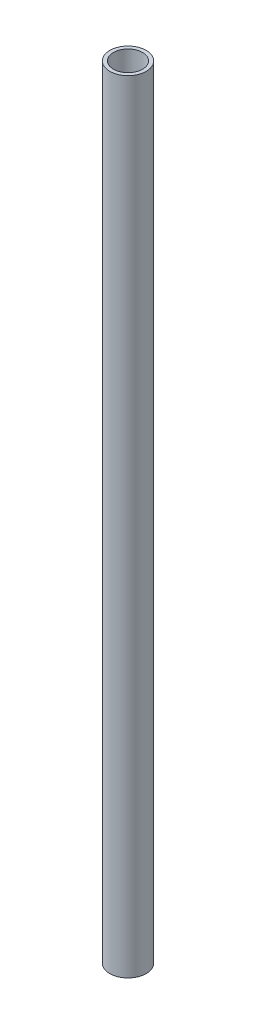
from build123d import *

# Parameters (mm, degrees)
TUBE_ROND_R            = 5
TUBE_ROND_R_2          = 4
TUBE_ROND_10X1_1_DEPTH = 215


with BuildPart() as part:
    # tube rond → Tube rond 10X1(1) (new body)
    with BuildSketch(Plane.XZ.offset(-107.5)):
        Circle(TUBE_ROND_R)
        Circle(TUBE_ROND_R_2, mode=Mode.SUBTRACT)
    extrude(amount=TUBE_ROND_10X1_1_DEPTH)


solid = part.part
